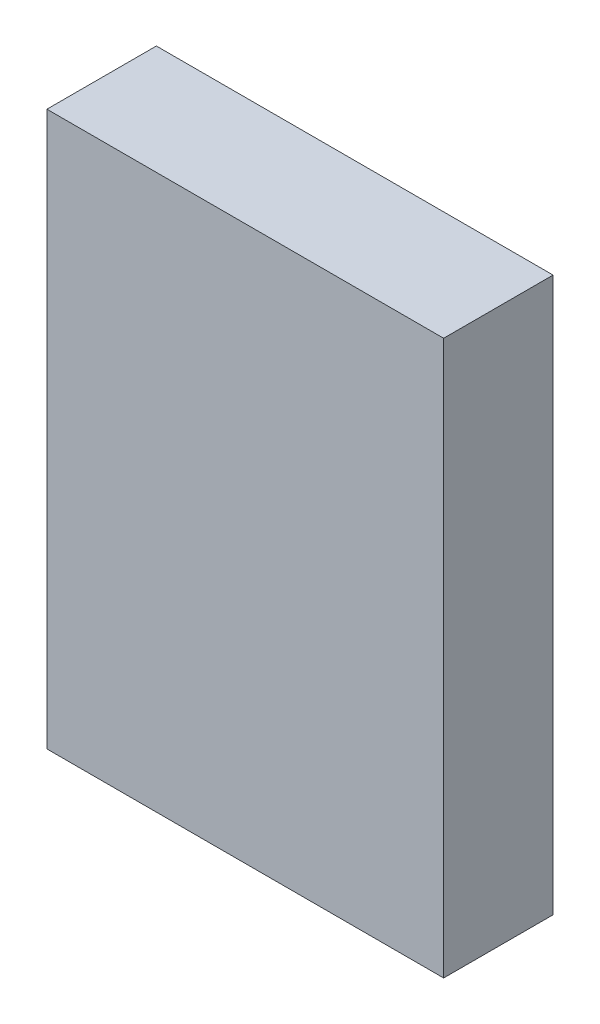
from build123d import *

# Parameters (mm, degrees)
SKETCH2_W           = 184.15
SKETCH2_H           = 257.175
BOSS_EXTRUDE1_DEPTH = 50.8


with BuildPart() as part:
    # Sketch2 → Boss-Extrude1 (new body)
    with BuildSketch(Plane.XY):
        with Locations((92.075, 128.5875)):
            Rectangle(SKETCH2_W, SKETCH2_H)
    extrude(amount=BOSS_EXTRUDE1_DEPTH)


solid = part.part
